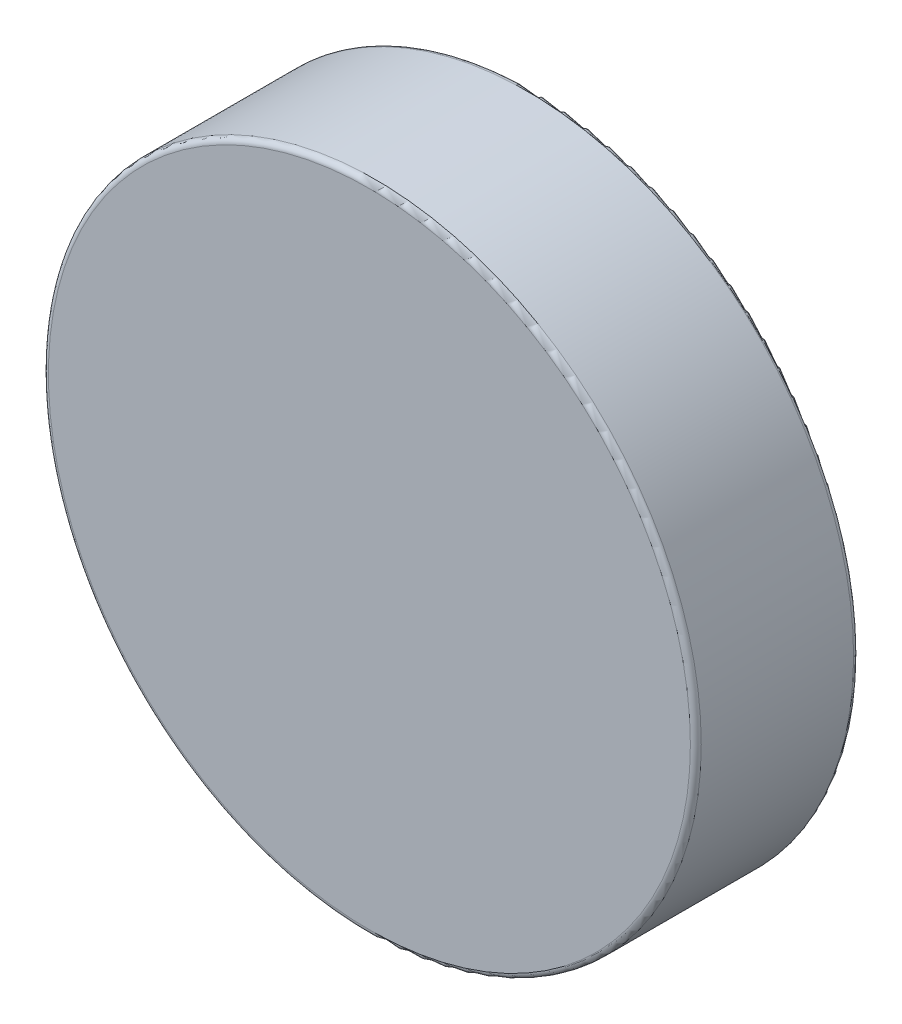
from build123d import *

# Parameters (mm, degrees)
SKETCH1_R           = 30
BOSS_EXTRUDE1_DEPTH = 7.5
FILLET1_R           = 0.5


with BuildPart() as part:
    # Sketch1 → Boss-Extrude1 (new, symmetric)
    with BuildSketch(Plane.XY):
        Circle(SKETCH1_R)
    extrude(amount=BOSS_EXTRUDE1_DEPTH, both=True)

    # Fillet1
    fillet1_edges = [part.edges().sort_by_distance(p)[0] for p in [
        (-30, 0, -7.5),
        (-30, 0, 7.5),
    ]]
    fillet(fillet1_edges, radius=FILLET1_R)


solid = part.part
